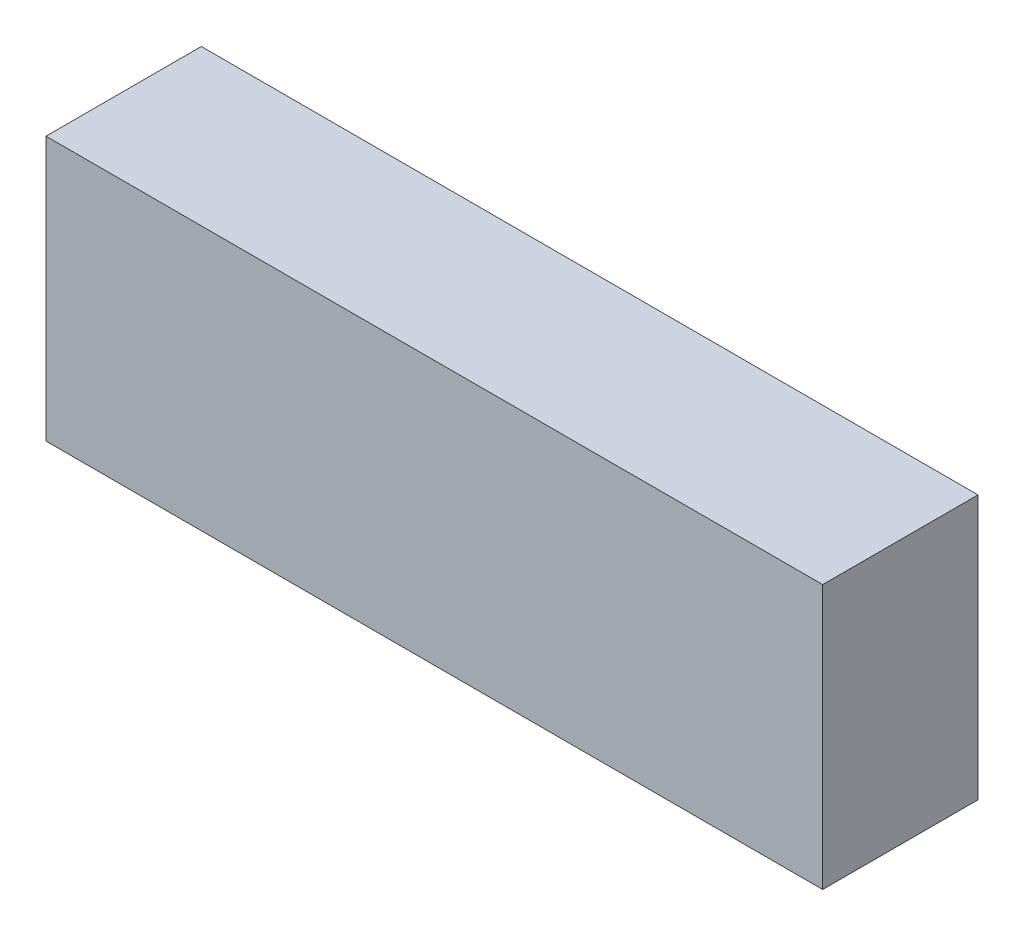
from build123d import *

# Parameters (mm, degrees)
SKETCH1_W           = 50
SKETCH1_H           = 17
BOSS_EXTRUDE1_DEPTH = 5


with BuildPart() as part:
    # Sketch1 → Boss-Extrude1 (new, symmetric)
    with BuildSketch(Plane.XY):
        Rectangle(SKETCH1_W, SKETCH1_H)
    extrude(amount=BOSS_EXTRUDE1_DEPTH, both=True)


solid = part.part
